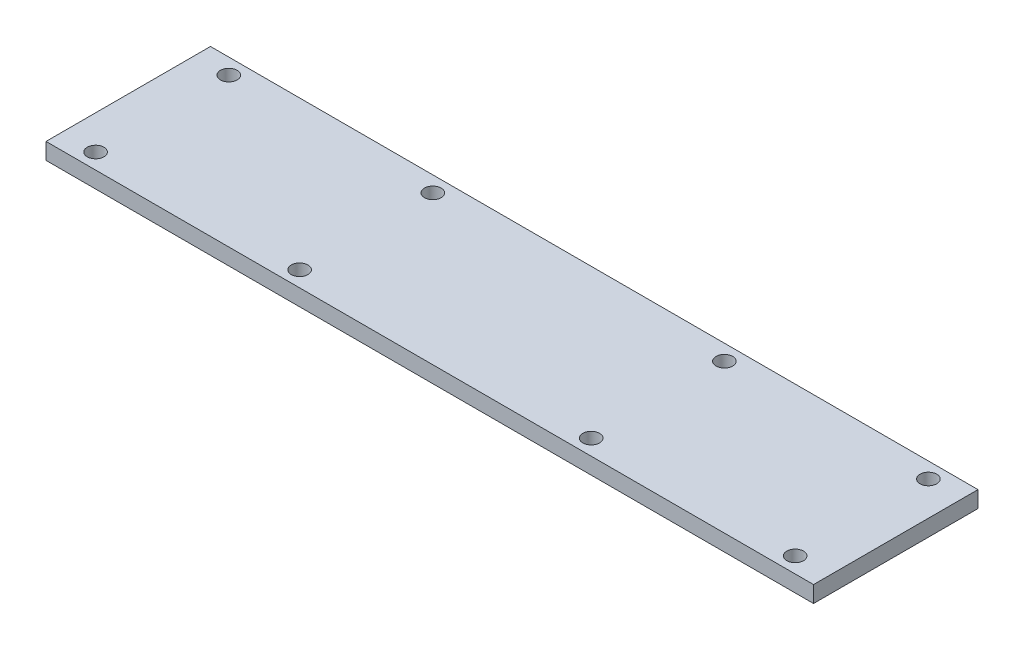
from build123d import *

# Parameters (mm, degrees)
SKETCH1_W           = 140
SKETCH1_H           = 30
SKETCH1_R           = 1.525
BOSS_EXTRUDE1_DEPTH = 3


with BuildPart() as part:
    # Sketch1 → Boss-Extrude1 (new body)
    with BuildSketch(Plane(origin=(0, 0, 0), x_dir=(1, 0, 0), z_dir=(0, 1, 0))):
        Rectangle(SKETCH1_W, SKETCH1_H)
        with Locations(Location((-63.8, 12.15, 0), (0, 0, 270))):
            Circle(SKETCH1_R, mode=Mode.SUBTRACT)
        with Locations(Location((-63.8, -12.15, 0), (0, 0, 90))):
            Circle(SKETCH1_R, mode=Mode.SUBTRACT)
        with Locations(Location((63.8, -12.15, 0), (0, 0, 270))):
            Circle(SKETCH1_R, mode=Mode.SUBTRACT)
        with Locations(Location((63.8, 12.15, 0), (0, 0, 90))):
            Circle(SKETCH1_R, mode=Mode.SUBTRACT)
        with Locations(Location((-26.595, 12.15, 0), (0, 0, 270))):
            Circle(SKETCH1_R, mode=Mode.SUBTRACT)
        with Locations(Location((-26.595, -12.15, 0), (0, 0, 90))):
            Circle(SKETCH1_R, mode=Mode.SUBTRACT)
        with Locations(Location((26.595, -12.15, 0), (0, 0, 270))):
            Circle(SKETCH1_R, mode=Mode.SUBTRACT)
        with Locations(Location((26.595, 12.15, 0), (0, 0, 90))):
            Circle(SKETCH1_R, mode=Mode.SUBTRACT)
    extrude(amount=BOSS_EXTRUDE1_DEPTH)


solid = part.part
